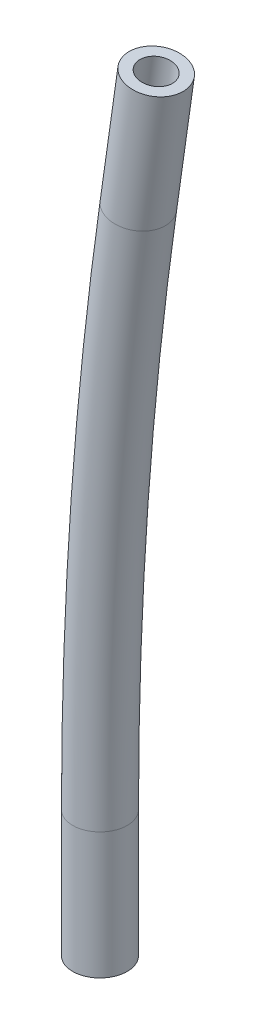
from build123d import *

# Parameters (mm, degrees)
SKETCH2_R   = 3.175
SKETCH2_R_2 = 1.905


with BuildPart() as part:
    # Sweep1: sweep along a path in Sketch1
    with BuildLine(Plane.XY) as sweep1_path:
        Line((0, 0), (0, 14.732))
        ThreePointArc((0, 14.732), (1.119415433, 46.391788803), (4.472070917, 77.89345573))
        Line((4.472070917, 77.89345573), (6.547827866, 92.478484256))
    # Sketch2 → Sweep1 (sweep)
    with BuildSketch(Plane(origin=(0, 0, 0), x_dir=(1, 0, 0), z_dir=(0, 1, 0))):
        Circle(SKETCH2_R)
        Circle(SKETCH2_R_2, mode=Mode.SUBTRACT)
    sweep(path=sweep1_path.line)


solid = part.part
